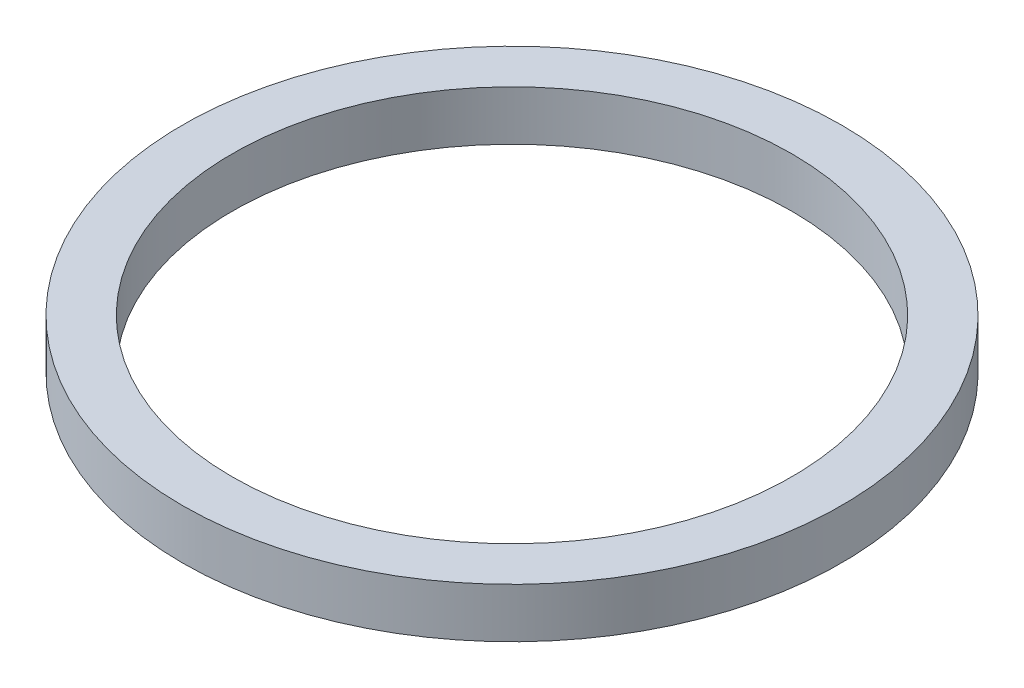
from build123d import *

# Parameters (mm, degrees)
SKETCH_1_R      = 53
SKETCH_1_R_2    = 45
EXTRUDE_1_DEPTH = 8


with BuildPart() as part:
    # 草图1 → 凸台-拉伸1 (new body)
    with BuildSketch(Plane(origin=(0, 0, 0), x_dir=(1, 0, 0), z_dir=(0, 1, 0))):
        with Locations(Location((0, 0, 0), (0, 0, 270))):
            Circle(SKETCH_1_R)
        with Locations(Location((0, 0, 0), (0, 0, 270))):
            Circle(SKETCH_1_R_2, mode=Mode.SUBTRACT)
    extrude(amount=EXTRUDE_1_DEPTH)


solid = part.part
